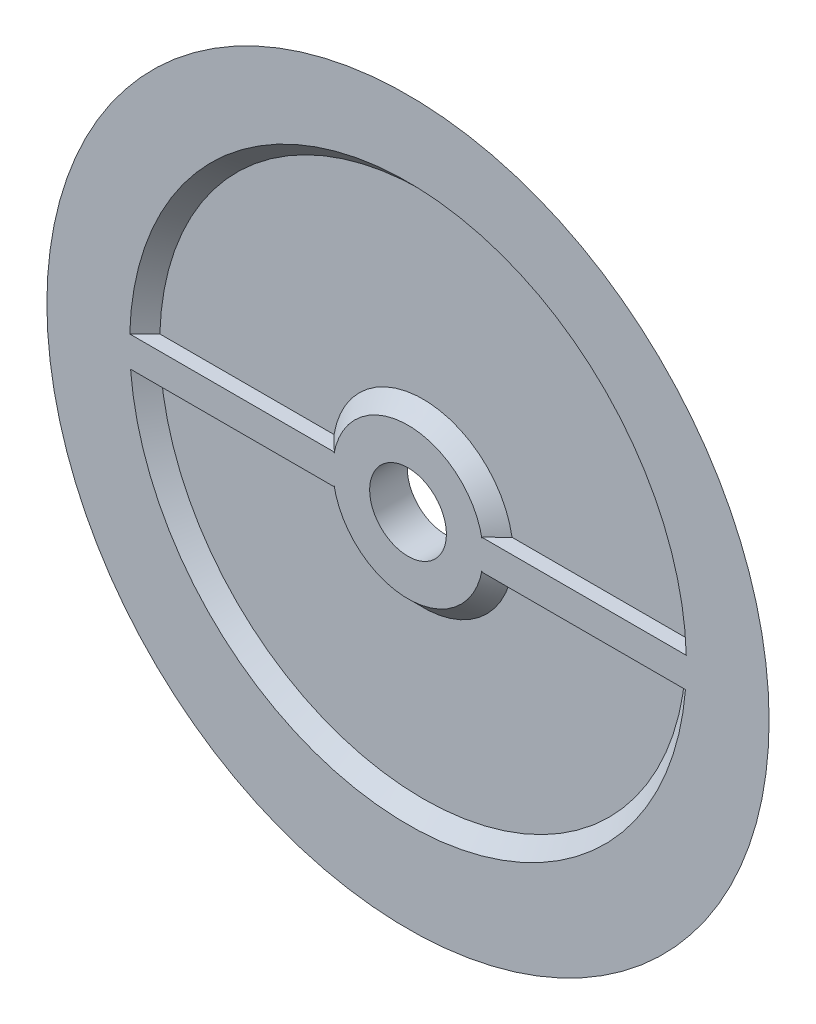
from build123d import *

# Parameters (mm, degrees)
SKETCH_1_R               = 37
EXTRUDE_1_DEPTH          = 5
SKETCH_4_R               = 34.4
SKETCH_4_R_2             = 30.4
EXTRUDE_2_DEPTH          = 0.8
SKETCH_5_R               = 5.1
CUT_EXTRUDE_1_DEPTH      = 69.066144301
SKETCH_6_R               = 37
SKETCH_6_R_2             = 10
CUT_EXTRUDE_2_DEPTH      = 2
CUT_EXTRUDE_2_DRAFT      = -45
SKETCH_7_W               = 25.320983541
SKETCH_7_H               = 4
EXTRUDE_3_DEPTH          = 2
SKETCH_9_W               = 2
SKETCH_9_H               = 4
EXTRUDE_5_DEPTH          = 5
PATTERN_CIRCULAR_1_COUNT = 2


with BuildPart() as part:
    # 스케치1 → 보스-돌출1 (new body)
    with BuildSketch(Plane.XY):
        Circle(SKETCH_1_R)
    extrude(amount=EXTRUDE_1_DEPTH)

    # 스케치3 → 회전1 (revolve)
    with BuildSketch(Plane(origin=(0, 0, 0), x_dir=(1, 0, 0), z_dir=(0, 1, 0)), mode=Mode.PRIVATE) as revolve_1_sk:
        Polygon((-37, -5), (-37, 0), (-48, -5), align=None)
    revolve(revolve_1_sk.sketch.rotate(Axis((0, 0, -6.462572401), (0, 0, 1)), 180), axis=Axis((0, 0, -6.462572401), (0, 0, 1)))

    # 스케치4 → 보스-돌출2 (add)
    with BuildSketch(Plane(origin=(0, 0, 0), x_dir=(-1, 0, 0), z_dir=(0, 0, -1))):
        with Locations(Location((0, 0, 0), (0, 0, 180))):
            Circle(SKETCH_4_R)
        Circle(SKETCH_4_R_2, mode=Mode.SUBTRACT)
    extrude(amount=EXTRUDE_2_DEPTH)

    # 스케치5 → 컷-돌출1 (cut, through all)
    with BuildSketch(Plane(origin=(0, 0, 0), x_dir=(-1, 0, 0), z_dir=(0, 0, -1))):
        Circle(SKETCH_5_R)
    extrude(amount=-CUT_EXTRUDE_1_DEPTH, mode=Mode.SUBTRACT)


with BuildPart() as cut_extrude_2_tool:
    # 스케치6 → 컷-돌출2 (with draft: the straight prism first)
    with BuildSketch(Plane.XY.offset(5)):
        with Locations((0, 0.990500037)):
            Circle(SKETCH_6_R)
        Circle(SKETCH_6_R_2, mode=Mode.SUBTRACT)
    extrude(amount=-CUT_EXTRUDE_2_DEPTH)
    # 컷-돌출2: the draft: its side faces are tilted about the plane it starts from
    cut_extrude_2_sides = [cut_extrude_2_tool.faces().sort_by_distance(p)[0] for p in [
        (-37, 0.990500037, 4),
        (-10, 0, 4),
    ]]
    draft(cut_extrude_2_sides, Plane.XY.offset(5), CUT_EXTRUDE_2_DRAFT)


with BuildPart() as part_1:
    add(part.part)

    # 컷-돌출2: cut by cut_extrude_2_tool
    add(cut_extrude_2_tool.part, mode=Mode.SUBTRACT)

    # 스케치7 → 보스-돌출3 (add)
    with BuildSketch(Plane.XY.offset(5)):
        with Locations((-27.526560518, 0)):
            Rectangle(SKETCH_7_W, SKETCH_7_H)
    extrude_3 = extrude(amount=-EXTRUDE_3_DEPTH)

    # 스케치9 → 보스-돌출5 (add)
    with BuildSketch(Plane(origin=(-14.866068747, 0, 0), x_dir=(0, 0, -1), z_dir=(1, 0, 0))):
        with Locations((-4, 0)):
            Rectangle(SKETCH_9_W, SKETCH_9_H)
    extrude_5 = extrude(amount=EXTRUDE_5_DEPTH)

    # 원형 패턴1: 보스-돌출3, 보스-돌출5 ×2 about axis
    pattern_circular_1_axis = Axis((0, 0, 0), (0, 0, 1))
    add([extrude_3.rotate(pattern_circular_1_axis, i * 360 / PATTERN_CIRCULAR_1_COUNT) for i in range(1, PATTERN_CIRCULAR_1_COUNT)])
    add([extrude_5.rotate(pattern_circular_1_axis, i * 360 / PATTERN_CIRCULAR_1_COUNT) for i in range(1, PATTERN_CIRCULAR_1_COUNT)])


solid = part_1.part
